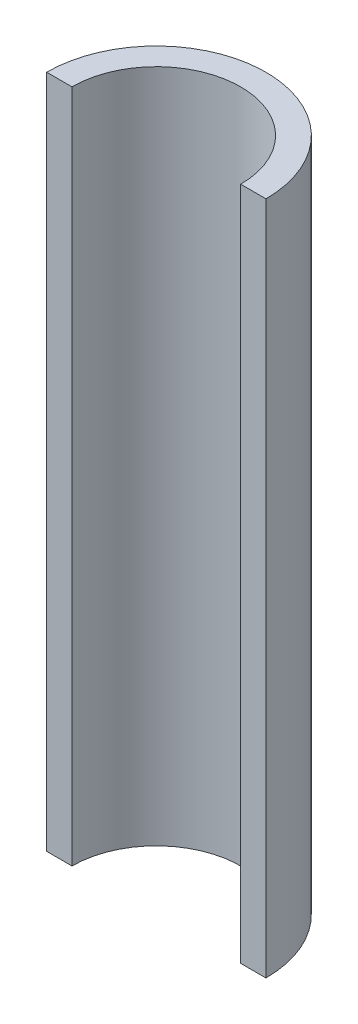
from build123d import *

# Parameters (mm, degrees)
BOSS_EXTRUDE1_DEPTH = 80


with BuildPart() as part:
    # Sketch1 → Boss-Extrude1 (new body)
    with BuildSketch(Plane(origin=(0, 0, 0), x_dir=(1, 0, 0), z_dir=(0, 1, 0))):
        with BuildLine():
            Line((-13, 0), (-10, 0))
            ThreePointArc((-10, 0), (0, 10), (10, 0))
            Line((10, 0), (13, 0))
            ThreePointArc((13, 0), (0, 13), (-13, 0))
        make_face()
    extrude(amount=BOSS_EXTRUDE1_DEPTH)


solid = part.part
